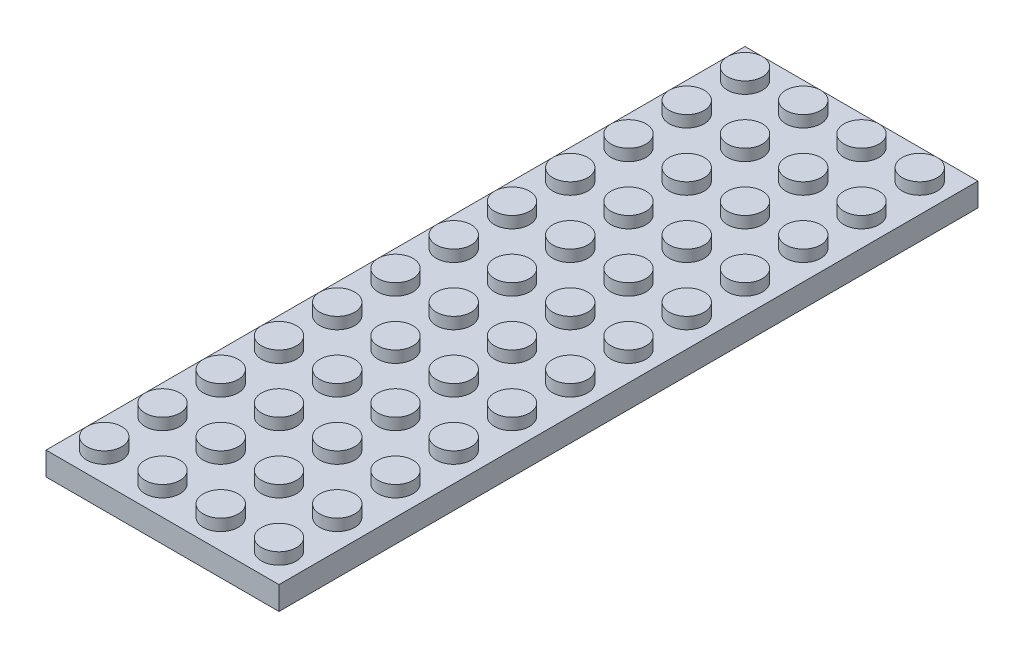
from build123d import *

# Parameters (mm, degrees)
SKETCH1_W            = 32
SKETCH1_H            = 96
BOSS_EXTRUDE1_DEPTH  = 3.2
SKETCH2_R            = 2.4
BOSS_EXTRUDE2_DEPTH  = 1.6
LPATTERN1_COUNT      = 4
LPATTERN1_PITCH      = 8
LPATTERN1_COUNT_DIR2 = 12
LPATTERN1_PITCH_DIR2 = 8
SHELL1_T             = -1.6


with BuildPart() as part:
    # Sketch1 → Boss-Extrude1 (new body)
    with BuildSketch(Plane(origin=(0, 0, 0), x_dir=(1, 0, 0), z_dir=(0, 1, 0))):
        with Locations((16, 48)):
            Rectangle(SKETCH1_W, SKETCH1_H)
    extrude(amount=BOSS_EXTRUDE1_DEPTH)

    # Sketch2 → Boss-Extrude2 (add)
    with BuildSketch(Plane(origin=(0, 3.2, 0), x_dir=(1, 0, 0), z_dir=(0, 1, 0))):
        with Locations(Location((28, 4, 0), (0, 0, 90))):
            Circle(SKETCH2_R)
    boss_extrude2 = extrude(amount=BOSS_EXTRUDE2_DEPTH)

    # LPattern1: Boss-Extrude2 4 × 12
    with Locations(*[(-i * LPATTERN1_PITCH, 0, -j * LPATTERN1_PITCH_DIR2) for i in range(LPATTERN1_COUNT) for j in range(LPATTERN1_COUNT_DIR2) if (i, j) != (0, 0)]):
        add(boss_extrude2)

    # Shell1
    shell1_openings = [part.faces().sort_by_distance(p)[0] for p in [
        (16, 0, -48),
    ]]
    offset(amount=SHELL1_T, openings=shell1_openings, kind=Kind.INTERSECTION)


solid = part.part
